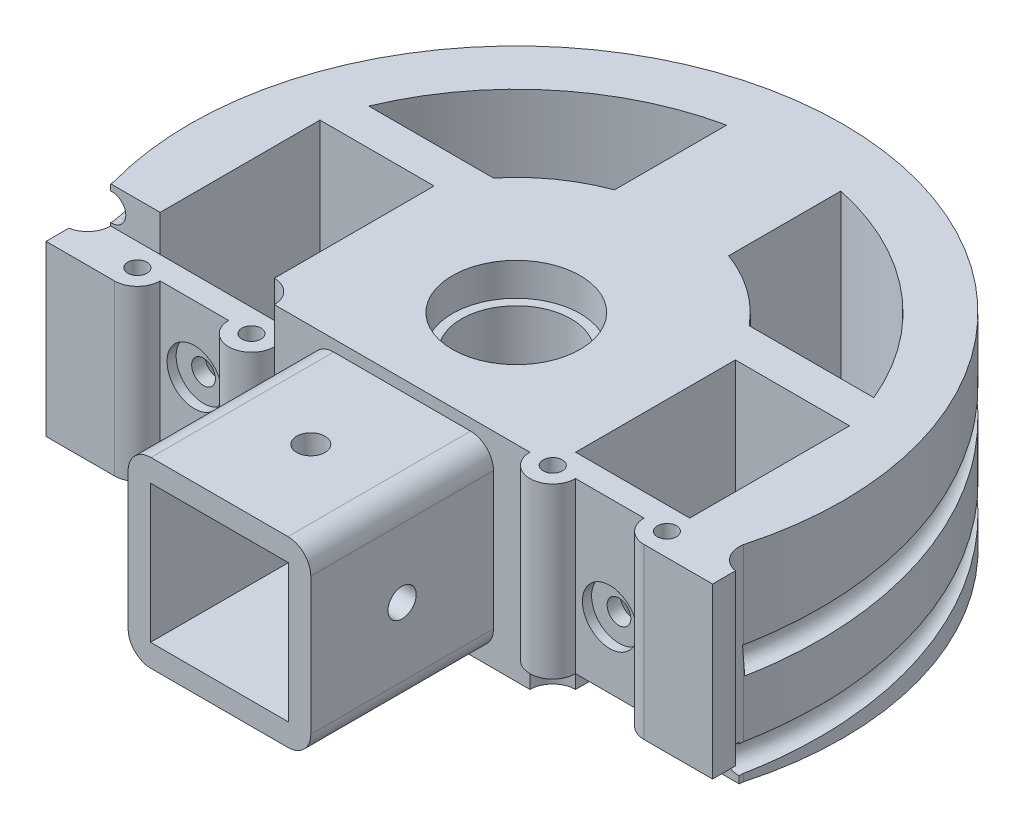
from build123d import *

# Parameters (mm, degrees)
SKETCH1_R               = 25
SKETCH1_R_2             = 14.05
BOSS_EXTRUDE1_DEPTH     = 45
CUT_EXTRUDE1_DEPTH      = 45
BOSS_EXTRUDE2_DEPTH     = 45
CHAMFER1_SIZE           = 4
CHAMFER2_SIZE           = 4
SKETCH5_R               = 5
BOSS_EXTRUDE4_DEPTH     = 45
BOSS_EXTRUDE5_DEPTH     = 45
SKETCH7_R               = 2.1
CUT_EXTRUDE2_DEPTH      = 45
CUT_EXTRUDE5_DEPTH      = 4
CUT_EXTRUDE6_START      = -4
CUT_EXTRUDE6_DEPTH      = 4
CUT_EXTRUDE8_DEPTH      = 105.754474845
SKETCH13_R              = 2.6
CUT_EXTRUDE9_DEPTH      = 59
SKETCH14_R              = 6.25
CUT_EXTRUDE10_DEPTH     = 2
CUT_EXTRUDE11_START     = -2
SKETCH15_R              = 6.25
CUT_EXTRUDE11_DEPTH     = 2
SKETCH16_R              = 2.6
CUT_EXTRUDE12_DEPTH     = 58
SKETCH17_R              = 6.25
CUT_EXTRUDE13_DEPTH     = 2
CUT_EXTRUDE14_START     = -2
SKETCH18_R              = 6.25
CUT_EXTRUDE14_DEPTH     = 2
SKETCH19_R              = 14.05
SKETCH19_R_2            = 11
BOSS_EXTRUDE7_DEPTH     = 45
SKETCH20_R              = 14.1
CUT_EXTRUDE15_DEPTH     = 7.2
CUT_EXTRUDE16_START     = -7.2
SKETCH21_R              = 14.1
CUT_EXTRUDE16_DEPTH     = 7.2
SKETCH22_W              = 40
SKETCH22_H              = 40
SKETCH22_W_2            = 30.2
SKETCH22_H_2            = 30.2
BOSS_EXTRUDE8_DEPTH     = 40
SKETCH23_W              = 40
SKETCH23_H              = 40
SKETCH23_W_2            = 30.2
SKETCH23_H_2            = 30.2
BOSS_EXTRUDE9_DEPTH     = 10
FILLET3_R               = 5
SKETCH24_R              = 3.1
CUT_EXTRUDE17_DEPTH     = 42
SKETCH25_R              = 3.1
CUT_EXTRUDE18_DEPTH     = 42
SKETCH26_W              = 30.2
SKETCH26_H              = 30.2
BOSS_EXTRUDE10_DEPTH    = 8
BOSS_EXTRUDE11_REACH    = 106.754
SKETCH27_R              = 14.1
SKETCH27_R_2            = 14
SKETCH28_R              = 11
SKETCH28_R_2            = 7.5
BOSS_EXTRUDE12_DEPTH    = 30.6
BOSS_EXTRUDE13_START    = -45
SKETCH29_R              = 14
BOSS_EXTRUDE13_DEPTH    = 45
CUT_EXTRUDE19_START     = -60
SKETCH30_R              = 76.647574574
SKETCH30_R_2            = 71.5
CUT_EXTRUDE19_DEPTH     = 60
SKETCH32_R              = 5
SKETCH32_R_2            = 2.1
BOSS_EXTRUDE14_DEPTH    = 45
SKETCH33_W              = 15.39767617
SKETCH33_H              = 7.776614116
SKETCH33_W_2            = 17.569143322
CUT_EXTRUDE23_DEPTH     = 60
SKETCH38_R              = 5
BOSS_EXTRUDE18_DEPTH    = 45
SKETCH39_R              = 2.1
CUT_EXTRUDE24_DEPTH     = 60
SKETCH40_W              = 25
SKETCH40_H              = 35
CUT_EXTRUDE25_DEPTH     = 60
CUT_EXTRUDE27_DEPTH     = 60
SKETCH43_R              = 2.6
CUT_EXTRUDE28_DEPTH     = 53
SKETCH46_R              = 6
CUT_EXTRUDE29_DEPTH     = 5
CUT_EXTRUDE30_START     = -2
SKETCH47_R              = 6
CUT_EXTRUDE30_DEPTH     = 2
BOSS_EXTRUDE19_DEPTH    = 45
BOSS_EXTRUDE20_DEPTH    = 45
CUT_EXTRUDE31_DEPTH     = 8
CUT_EXTRUDE32_START     = -8
CUT_EXTRUDE32_DEPTH     = 8
CUT_SWEEP16_PITCH       = 30
CUT_SWEEP16_HEIGHT      = 18
CUT_SWEEP16_RADIUS      = 71.5
CUT_SWEEP16_START_ANGLE = -110.5
CUT_SWEEP16_PROFILE_R   = 3
CUT_SWEEP17_PITCH       = 30.5
CUT_SWEEP17_HEIGHT      = 18.3
CUT_SWEEP17_RADIUS      = 71.5
CUT_SWEEP17_START_ANGLE = -105.5
CUT_SWEEP17_PROFILE_R   = 3
SKETCH134_R             = 12
CUT_EXTRUDE33_DEPTH     = 30.6


with BuildPart() as part:
    # Sketch1 → Boss-Extrude1 (new body)
    # profile 1 of 2: a face of its own
    with BuildSketch(Plane(origin=(0, 0, 0), x_dir=(1, 0, 0), z_dir=(0, 1, 0))):
        Circle(SKETCH1_R)
        with Locations(Location((0, 0, 0), (0, 0, 90))):
            Circle(SKETCH1_R_2, mode=Mode.SUBTRACT)
    # profile 2 of 2: a face of its own
    with BuildSketch(Plane(origin=(0, 0, 0), x_dir=(1, 0, 0), z_dir=(0, 1, 0))):
        with BuildLine():
            Line((-62.39343856, 27.038099501), (-17.67766953, -17.67766953))
            ThreePointArc((-17.67766953, -17.67766953), (-9.567085809, 23.096988313), (25, 0))
            ThreePointArc((25, 0), (23.096988313, -9.567085809), (17.67766953, -17.67766953))
            Line((17.67766953, -17.67766953), (62.39343856, 27.038099501))
            ThreePointArc((62.39343856, 27.038099501), (0, 68), (-62.39343856, 27.038099501))
        make_face()
        Polygon((-33.941125497, 8.485281374), (-51.618795027, 26.162950904), (-33.941125497, 43.840620434), (-16.263455967, 26.162950904), align=None, mode=Mode.SUBTRACT)
        Polygon((33.941125497, 43.840620434), (51.618795027, 26.162950904), (33.941125497, 8.485281374), (16.263455967, 26.162950904), align=None, mode=Mode.SUBTRACT)
    extrude(amount=BOSS_EXTRUDE1_DEPTH)

    # Sketch2 → Cut-Extrude1 (cut)
    with BuildSketch(Plane(origin=(0, 45, 0), x_dir=(1, 0, 0), z_dir=(0, 1, 0))):
        Polygon((-51.618795027, 26.162950904), (-23.334523779, 54.447222151), (-5.656854249, 36.769552622), (-33.941125497, 8.485281374), align=None)
        Polygon((33.941125497, 8.485281374), (5.656854249, 36.769552622), (23.334523779, 54.447222151), (51.618795027, 26.162950904), align=None)
    extrude(amount=-CUT_EXTRUDE1_DEPTH, mode=Mode.SUBTRACT)

    # Sketch3 → Boss-Extrude2 (add)
    with BuildSketch(Plane(origin=(0, 45, 0), x_dir=(1, 0, 0), z_dir=(0, 1, 0))):
        Polygon((-20.506096654, 51.618795027), (-48.790367902, 23.334523779), (-51.618795027, 26.162950904), (-23.334523779, 54.447222151), align=None)
        Polygon((-33.941125497, 8.485281374), (-36.769552622, 11.313708499), (-8.485281374, 39.597979746), (-5.656854249, 36.769552622), align=None)
        Polygon((8.485281374, 39.597979746), (5.656854249, 36.769552622), (33.941125497, 8.485281374), (36.769552622, 11.313708499), align=None)
        Polygon((51.618795027, 26.162950904), (23.334523779, 54.447222151), (20.506096654, 51.618795027), (48.790367902, 23.334523779), align=None)
    extrude(amount=-BOSS_EXTRUDE2_DEPTH)

    # Chamfer1
    chamfer1_edges = [part.edges().sort_by_distance(p)[0] for p in [
        (22.627416998, 45, -25.455844123),
        (34.648232278, 45, -37.476659403),
        (-34.648232278, 45, -37.476659403),
        (-22.627416998, 45, -25.455844123),
    ]]
    chamfer(chamfer1_edges, length=CHAMFER1_SIZE)

    # Chamfer2
    chamfer2_edges = [part.edges().sort_by_distance(p)[0] for p in [
        (22.627416998, 0, -25.455844123),
        (34.648232278, 0, -37.476659403),
        (-34.648232278, 0, -37.476659403),
        (-22.627416998, 0, -25.455844123),
    ]]
    chamfer(chamfer2_edges, length=CHAMFER2_SIZE)

    # Sketch5 → Boss-Extrude4 (add)
    with BuildSketch(Plane(origin=(0, 45, 0), x_dir=(1, 0, 0), z_dir=(0, 1, 0))):
        with Locations((-57.982756057, 22.627416998)):
            Circle(SKETCH5_R)
        with Locations((-37.476659403, 2.121320344)):
            Circle(SKETCH5_R)
        with Locations((37.476659403, 2.121320344)):
            Circle(SKETCH5_R)
        with Locations((57.982756057, 22.627416998)):
            Circle(SKETCH5_R)
    extrude(amount=-BOSS_EXTRUDE4_DEPTH)

    # Sketch6 → Boss-Extrude5 (add)
    with BuildSketch(Plane(origin=(0, 45, 0), x_dir=(1, 0, 0), z_dir=(0, 1, 0))):
        with BuildLine():
            Line((-61.518289963, 26.162950904), (-65.76093065, 30.405591591))
            Line((-65.76093065, 30.405591591), (-63.901330634, 33.947044369))
            ThreePointArc((-63.901330634, 33.947044369), (-59.108926918, 35.861508459), (-55.392465948, 39.442042495))
            Line((-55.392465948, 39.442042495), (-61.518289963, 26.162950904))
        make_face()
        with BuildLine():
            Line((65.76093065, 30.405591591), (63.901330634, 33.947044369))
            ThreePointArc((63.901330634, 33.947044369), (59.108926918, 35.861508459), (55.392465948, 39.442042495))
            Line((55.392465948, 39.442042495), (61.518289963, 26.162950904))
            Line((61.518289963, 26.162950904), (65.76093065, 30.405591591))
        make_face()
    extrude(amount=-BOSS_EXTRUDE5_DEPTH)

    # Sketch7 → Cut-Extrude2 (cut)
    with BuildSketch(Plane(origin=(0, 45, 0), x_dir=(1, 0, 0), z_dir=(0, 1, 0))):
        with Locations(Location((-57.982756057, 22.627416998, 0), (0, 0, 270))):
            Circle(SKETCH7_R)
        with Locations(Location((-37.476659403, 2.121320344, 0), (0, 0, 270))):
            Circle(SKETCH7_R)
        with Locations(Location((57.982756057, 22.627416998, 0), (0, 0, 270))):
            Circle(SKETCH7_R)
        with Locations(Location((37.476659403, 2.121320344, 0), (0, 0, 270))):
            Circle(SKETCH7_R)
    extrude(amount=-CUT_EXTRUDE2_DEPTH, mode=Mode.SUBTRACT)

    # Sketch9 → Cut-Extrude5 (cut)
    with BuildSketch(Plane(origin=(0, 45, 0), x_dir=(1, 0, 0), z_dir=(0, 1, 0))):
        with BuildLine():
            Line((34.430855211, 8.975011088), (63.662724611, 38.206880488))
            Line((63.662724611, 38.206880488), (69.319578861, 32.550026239))
            Line((69.319578861, 32.550026239), (61.518289963, 26.162950904))
            ThreePointArc((61.518289963, 26.162950904), (61.518289963, 19.091883092), (54.447222151, 19.091883092))
            Line((54.447222151, 19.091883092), (42.779960262, 7.424621202))
            ThreePointArc((42.779960262, 7.424621202), (36.107353009, -5.252620258), (34.430855211, 8.975011088))
        make_face()
        with BuildLine():
            Line((-54.447222151, 19.091883092), (-42.779960262, 7.424621202))
            ThreePointArc((-42.779960262, 7.424621202), (-36.107353009, -5.252620258), (-34.430855211, 8.975011088))
            Line((-34.430855211, 8.975011088), (-63.662724611, 38.206880488))
            Line((-63.662724611, 38.206880488), (-69.319578861, 32.550026239))
            Line((-69.319578861, 32.550026239), (-61.518289963, 26.162950904))
            ThreePointArc((-61.518289963, 26.162950904), (-61.518289963, 19.091883092), (-54.447222151, 19.091883092))
        make_face()
    extrude(amount=-CUT_EXTRUDE5_DEPTH, mode=Mode.SUBTRACT)

    # Sketch10 → Cut-Extrude6 (cut)
    with BuildSketch(Plane(origin=(0, 0, 0), x_dir=(-1, 0, 0), z_dir=(0, -1, 0)).offset(CUT_EXTRUDE6_START)):
        with BuildLine():
            Line((-34.430855211, 8.975011088), (-64.753514476, 39.297670354))
            Line((-64.753514476, 39.297670354), (-71.152151943, 32.899032887))
            Line((-71.152151943, 32.899032887), (-62.982756057, 22.627416998))
            ThreePointArc((-62.982756057, 22.627416998), (-61.363317821, 18.943424305), (-57.554035193, 17.645831064))
            Line((-57.554035193, 17.645831064), (-44.542961969, 4.63475784))
            ThreePointArc((-44.542961969, 4.63475784), (-34.518526316, -4.770664033), (-34.430855211, 8.975011088))
        make_face()
        with BuildLine():
            Line((71.152151943, 32.899032887), (62.982756057, 22.627416998))
            ThreePointArc((62.982756057, 22.627416998), (61.363317821, 18.943424305), (57.554035193, 17.645831064))
            Line((57.554035193, 17.645831064), (44.542961969, 4.63475784))
            ThreePointArc((44.542961969, 4.63475784), (34.518526316, -4.770664033), (34.430855211, 8.975011088))
            Line((34.430855211, 8.975011088), (64.753514476, 39.297670354))
            Line((64.753514476, 39.297670354), (71.152151943, 32.899032887))
        make_face()
    extrude(amount=CUT_EXTRUDE6_DEPTH, mode=Mode.SUBTRACT)

    # Sketch11 → Cut-Extrude8 (cut, through all)
    with BuildSketch(Plane(origin=(0, 45, 0), x_dir=(1, 0, 0), z_dir=(0, 1, 0))):
        with BuildLine():
            Line((0, 39.597979746), (-17.113067777, 56.711047524))
            ThreePointArc((-17.113067777, 56.711047524), (0, 59.236812878), (17.113067777, 56.711047524))
            Line((17.113067777, 56.711047524), (0, 39.597979746))
        make_face()
    extrude(amount=-CUT_EXTRUDE8_DEPTH, mode=Mode.SUBTRACT)

    # Sketch13 → Cut-Extrude9 (cut)
    with BuildSketch(Plane(origin=(17.67766953, 0, 17.67766953), x_dir=(0.7071067811865512, 0, -0.7071067811865438), z_dir=(0.7071067811865438, 0, 0.7071067811865512))):
        with Locations((42.5, 22.5)):
            Circle(SKETCH13_R)
    extrude(amount=-CUT_EXTRUDE9_DEPTH, mode=Mode.SUBTRACT)

    # Sketch14 → Cut-Extrude10 (cut)
    with BuildSketch(Plane(origin=(17.67766953, 0, 17.67766953), x_dir=(0.7071067811865512, 0, -0.7071067811865438), z_dir=(0.7071067811865438, 0, 0.7071067811865512))):
        with Locations((42.5, 22.5)):
            Circle(SKETCH14_R)
    extrude(amount=-CUT_EXTRUDE10_DEPTH, mode=Mode.SUBTRACT)

    # Sketch15 → Cut-Extrude11 (cut)
    with BuildSketch(Plane(origin=(-19.798989873, 0, -19.798989873), x_dir=(-0.7071067811865487, 0, 0.7071067811865465), z_dir=(-0.7071067811865465, 0, -0.7071067811865487)).offset(CUT_EXTRUDE11_START)):
        with Locations(Location((-42.5, 22.5, 0), (0, 0, 180))):
            Circle(SKETCH15_R)
    extrude(amount=CUT_EXTRUDE11_DEPTH, mode=Mode.SUBTRACT)

    # Sketch16 → Cut-Extrude12 (cut)
    with BuildSketch(Plane(origin=(-17.67766953, 0, 17.67766953), x_dir=(0.7071067811865512, 0, 0.7071067811865438), z_dir=(-0.7071067811865438, 0, 0.7071067811865512))):
        with Locations((-42.5, 22.5)):
            Circle(SKETCH16_R)
    extrude(amount=-CUT_EXTRUDE12_DEPTH, mode=Mode.SUBTRACT)

    # Sketch17 → Cut-Extrude13 (cut)
    with BuildSketch(Plane(origin=(-17.67766953, 0, 17.67766953), x_dir=(0.7071067811865512, 0, 0.7071067811865438), z_dir=(-0.7071067811865438, 0, 0.7071067811865512))):
        with Locations((-42.5, 22.5)):
            Circle(SKETCH17_R)
    extrude(amount=-CUT_EXTRUDE13_DEPTH, mode=Mode.SUBTRACT)

    # Sketch18 → Cut-Extrude14 (cut)
    with BuildSketch(Plane(origin=(19.798989873, 0, -19.798989873), x_dir=(-0.7071067811865475, 0, -0.7071067811865477), z_dir=(0.7071067811865477, 0, -0.7071067811865475)).offset(CUT_EXTRUDE14_START)):
        with Locations(Location((42.5, 22.5, 0), (0, 0, 180))):
            Circle(SKETCH18_R)
    extrude(amount=CUT_EXTRUDE14_DEPTH, mode=Mode.SUBTRACT)

    # Sketch19 → Boss-Extrude7 (add)
    with BuildSketch(Plane(origin=(0, 0, 0), x_dir=(-1, 0, 0), z_dir=(0, -1, 0))):
        Circle(SKETCH19_R)
        with Locations(Location((0, 0, 0), (0, 0, 90))):
            Circle(SKETCH19_R_2, mode=Mode.SUBTRACT)
    extrude(amount=-BOSS_EXTRUDE7_DEPTH)

    # Sketch20 → Cut-Extrude15 (cut)
    with BuildSketch(Plane(origin=(0, 45, 0), x_dir=(1, 0, 0), z_dir=(0, 1, 0))):
        with Locations(Location((0, 0, 0), (0, 0, 270))):
            Circle(SKETCH20_R)
    extrude(amount=-CUT_EXTRUDE15_DEPTH, mode=Mode.SUBTRACT)

    # Sketch21 → Cut-Extrude16 (cut)
    with BuildSketch(Plane(origin=(0, 0, 0), x_dir=(-1, 0, 0), z_dir=(0, -1, 0)).offset(CUT_EXTRUDE16_START)):
        with Locations(Location((0, 0, 0), (0, 0, 270))):
            Circle(SKETCH21_R)
    extrude(amount=CUT_EXTRUDE16_DEPTH, mode=Mode.SUBTRACT)



with BuildPart() as body_2:
    # Sketch22 → Boss-Extrude8 (new body)
    with BuildSketch(Plane.XY.offset(25)):
        with Locations((0, 22.5)):
            Rectangle(SKETCH22_W, SKETCH22_H)
        with Locations((0, 22.5)):
            Rectangle(SKETCH22_W_2, SKETCH22_H_2, mode=Mode.SUBTRACT)
    extrude(amount=BOSS_EXTRUDE8_DEPTH)


with BuildPart() as part_1:
    add(part.part)

    add(body_2.part)  # Boss-Extrude9 merges body 2
    # Sketch23 → Boss-Extrude9 (add)
    with BuildSketch(Plane(origin=(0, 0, 25), x_dir=(-1, 0, 0), z_dir=(0, 0, -1))):
        with Locations((0, 22.5)):
            Rectangle(SKETCH23_W, SKETCH23_H)
        with Locations((0, 22.5)):
            Rectangle(SKETCH23_W_2, SKETCH23_H_2, mode=Mode.SUBTRACT)
    extrude(amount=BOSS_EXTRUDE9_DEPTH)

    # Fillet3
    fillet3_edges = [part_1.edges().sort_by_distance(p)[0] for p in [
        (-20, 2.5, 40.17766953),
        (-20, 42.5, 40.17766953),
        (20, 2.5, 40.17766953),
        (20, 42.5, 40.17766953),
    ]]
    fillet(fillet3_edges, radius=FILLET3_R)

    # Sketch24 → Cut-Extrude17 (cut)
    with BuildSketch(Plane(origin=(0, 42.5, 0), x_dir=(1, 0, 0), z_dir=(0, 1, 0))):
        with Locations(Location((0, -45, 0), (0, 0, 270))):
            Circle(SKETCH24_R)
    extrude(amount=-CUT_EXTRUDE17_DEPTH, mode=Mode.SUBTRACT)

    # Sketch25 → Cut-Extrude18 (cut)
    with BuildSketch(Plane.ZY.offset(20)):
        with Locations((45, 22.5)):
            Circle(SKETCH25_R)
    extrude(amount=-CUT_EXTRUDE18_DEPTH, mode=Mode.SUBTRACT)

    # Sketch26 → Boss-Extrude10 (add)
    with BuildSketch(Plane.XY.offset(25)):
        with Locations((0, 22.5)):
            Rectangle(SKETCH26_W, SKETCH26_H)
    extrude(amount=-BOSS_EXTRUDE10_DEPTH)

    # Boss-Extrude11: up to this face of the body (flat: up to its plane)
    boss_extrude11_end = Plane(part_1.part.faces().sort_by_distance((0, 45, -25.755665333))[0])
    # Sketch27 → Boss-Extrude11 (add, up to the picked face)
    with BuildSketch(Plane(origin=(0, 0, 0), x_dir=(-1, 0, 0), z_dir=(0, -1, 0)), mode=Mode.PRIVATE) as boss_extrude11_sk1:
        Circle(SKETCH27_R)
        with Locations(Location((0, 0, 0), (0, 0, 90))):
            Circle(SKETCH27_R_2, mode=Mode.SUBTRACT)
    boss_extrude11_tool1 = split(extrude(boss_extrude11_sk1.sketch, amount=-BOSS_EXTRUDE11_REACH, mode=Mode.PRIVATE), bisect_by=boss_extrude11_end, keep=Keep.BOTH, mode=Mode.PRIVATE)
    add(boss_extrude11_tool1.solids().sort_by(Axis((14.060119, 0, 0), (0, 1, 0)))[0])

    # Sketch28 → Boss-Extrude12 (add)
    with BuildSketch(Plane(origin=(0, 7.2, 0), x_dir=(-1, 0, 0), z_dir=(0, -1, 0))):
        Circle(SKETCH28_R)
        with Locations(Location((0, 0, 0), (0, 0, 90))):
            Circle(SKETCH28_R_2, mode=Mode.SUBTRACT)
    extrude(amount=-BOSS_EXTRUDE12_DEPTH)

    # Sketch29 → Boss-Extrude13 (add)
    with BuildSketch(Plane(origin=(0, 45, 0), x_dir=(1, 0, 0), z_dir=(0, 1, 0)).offset(BOSS_EXTRUDE13_START)):
        with BuildLine():
            Line((0, -25), (-66.986939025, -25))
            ThreePointArc((-66.986939025, -25), (0, 71.5), (66.986939025, -25))
            Line((66.986939025, -25), (0, -25))
        make_face()
        with Locations(Location((0, 0, 0), (0, 0, 270))):
            Circle(SKETCH29_R, mode=Mode.SUBTRACT)
    extrude(amount=BOSS_EXTRUDE13_DEPTH)

    # Sketch30 → Cut-Extrude19 (cut)
    with BuildSketch(Plane(origin=(0, 45, 0), x_dir=(1, 0, 0), z_dir=(0, 1, 0)).offset(CUT_EXTRUDE19_START)):
        Circle(SKETCH30_R)
        Circle(SKETCH30_R_2, mode=Mode.SUBTRACT)
    extrude(amount=CUT_EXTRUDE19_DEPTH, mode=Mode.SUBTRACT)

    # Sketch32 → Boss-Extrude14 (add)
    # profile 1 of 4: a face of its own
    with BuildSketch(Plane(origin=(0, 45, 0), x_dir=(1, 0, 0), z_dir=(0, 1, 0))):
        with Locations((-57.986939025, -25)):
            Circle(SKETCH32_R)
        with Locations((-57.986939025, -25)):
            Circle(SKETCH32_R_2, mode=Mode.SUBTRACT)
    # profile 2 of 4: a face of its own
    with BuildSketch(Plane(origin=(0, 45, 0), x_dir=(1, 0, 0), z_dir=(0, 1, 0))):
        with Locations((-36.962147295, -25)):
            Circle(SKETCH32_R)
        with Locations((-36.962147295, -25)):
            Circle(SKETCH32_R_2, mode=Mode.SUBTRACT)
    # profile 3 of 4: a face of its own
    with BuildSketch(Plane(origin=(0, 45, 0), x_dir=(1, 0, 0), z_dir=(0, 1, 0))):
        with Locations((36.962147295, -25)):
            Circle(SKETCH32_R)
        with Locations((36.962147295, -25)):
            Circle(SKETCH32_R_2, mode=Mode.SUBTRACT)
    # profile 4 of 4: a face of its own
    with BuildSketch(Plane(origin=(0, 45, 0), x_dir=(1, 0, 0), z_dir=(0, 1, 0))):
        with Locations((57.986939025, -25)):
            Circle(SKETCH32_R)
        with Locations((57.986939025, -25)):
            Circle(SKETCH32_R_2, mode=Mode.SUBTRACT)
    extrude(amount=-BOSS_EXTRUDE14_DEPTH)

    # Sketch33 → Cut-Extrude23 (cut)
    with BuildSketch(Plane(origin=(0, 45, 0), x_dir=(1, 0, 0), z_dir=(0, 1, 0))):
        with Locations((-37.112347692, -28.888307058)):
            Rectangle(SKETCH33_W, SKETCH33_H)
        with Locations((36.026614116, -28.888307058)):
            Rectangle(SKETCH33_W_2, SKETCH33_H)
    extrude(amount=-CUT_EXTRUDE23_DEPTH, mode=Mode.SUBTRACT)

    # Sketch38 → Boss-Extrude18 (add)
    with BuildSketch(Plane(origin=(0, 45, 0), x_dir=(1, 0, 0), z_dir=(0, 1, 0))):
        with Locations((-57.986939025, -25)):
            Circle(SKETCH38_R)
        with Locations((57.986939025, -25)):
            Circle(SKETCH38_R)
        with Locations((-32.986939025, -25)):
            Circle(SKETCH38_R)
        with Locations((32.986939025, -25)):
            Circle(SKETCH38_R)
    extrude(amount=-BOSS_EXTRUDE18_DEPTH)

    # Sketch39 → Cut-Extrude24 (cut)
    with BuildSketch(Plane(origin=(0, 45, 0), x_dir=(1, 0, 0), z_dir=(0, 1, 0))):
        with Locations(Location((-57.986939025, -25, 0), (0, 0, 270))):
            Circle(SKETCH39_R)
        with Locations(Location((-32.986939025, -25, 0), (0, 0, 270))):
            Circle(SKETCH39_R)
        with Locations(Location((32.986939025, -25, 0), (0, 0, 270))):
            Circle(SKETCH39_R)
        with Locations(Location((57.986939025, -25, 0), (0, 0, 270))):
            Circle(SKETCH39_R)
    extrude(amount=-CUT_EXTRUDE24_DEPTH, mode=Mode.SUBTRACT)

    # Sketch40 → Cut-Extrude25 (cut)
    with BuildSketch(Plane(origin=(0, 45, 0), x_dir=(1, 0, 0), z_dir=(0, 1, 0))):
        with Locations((-45.486939025, -2.5)):
            Rectangle(SKETCH40_W, SKETCH40_H)
        with Locations((45.486939025, -2.5)):
            Rectangle(SKETCH40_W, SKETCH40_H)
    extrude(amount=-CUT_EXTRUDE25_DEPTH, mode=Mode.SUBTRACT)

    # Sketch42 → Cut-Extrude27 (cut)
    with BuildSketch(Plane(origin=(0, 45, 0), x_dir=(1, 0, 0), z_dir=(0, 1, 0))):
        with BuildLine():
            Line((-55.303572195, 23), (-32.986939025, 23))
            Line((-32.986939025, 23), (-28.002466789, 23))
            ThreePointArc((-28.002466789, 23), (0, 36.23724805), (28.002466789, 23))
            Line((28.002466789, 23), (55.303572195, 23))
            ThreePointArc((55.303572195, 23), (0, 59.89561835), (-55.303572195, 23))
        make_face()
    extrude(amount=-CUT_EXTRUDE27_DEPTH, mode=Mode.SUBTRACT)

    # Sketch43 → Cut-Extrude28 (cut)
    with BuildSketch(Plane.XY.offset(25)):
        with Locations((-45.486939025, 22.5)):
            Circle(SKETCH43_R)
        with Locations((45.486939025, 22.5)):
            Circle(SKETCH43_R)
    extrude(amount=-CUT_EXTRUDE28_DEPTH, mode=Mode.SUBTRACT)

    # Sketch46 → Cut-Extrude29 (cut)
    with BuildSketch(Plane(origin=(0, 0, -23), x_dir=(-1, 0, 0), z_dir=(0, 0, -1))):
        with Locations((45.486939025, 22.5)):
            Circle(SKETCH46_R)
        with Locations((-45.486939025, 22.5)):
            Circle(SKETCH46_R)
    extrude(amount=-CUT_EXTRUDE29_DEPTH, mode=Mode.SUBTRACT)

    # Sketch47 → Cut-Extrude30 (cut)
    with BuildSketch(Plane.XY.offset(25).offset(CUT_EXTRUDE30_START)):
        with Locations(Location((45.486939025, 22.5, 0), (0, 0, 180))):
            Circle(SKETCH47_R)
        with Locations(Location((-45.486939025, 22.5, 0), (0, 0, 180))):
            Circle(SKETCH47_R)
    extrude(amount=CUT_EXTRUDE30_DEPTH, mode=Mode.SUBTRACT)

    # Sketch48 → Boss-Extrude19 (add)
    with BuildSketch(Plane(origin=(0, 45, 0), x_dir=(1, 0, 0), z_dir=(0, 1, 0))):
        with BuildLine():
            Line((-12.5, 34.013058467), (-12.5, 58.576745365))
            ThreePointArc((-12.5, 58.576745365), (0, 59.89561835), (12.5, 58.576745365))
            Line((12.5, 58.576745365), (12.5, 34.013058467))
            ThreePointArc((12.5, 34.013058467), (0, 36.23724805), (-12.5, 34.013058467))
        make_face()
    extrude(amount=-BOSS_EXTRUDE19_DEPTH)

    # Sketch49 → Boss-Extrude20 (add)
    with BuildSketch(Plane(origin=(0, 45, 0), x_dir=(1, 0, 0), z_dir=(0, 1, 0))):
        with BuildLine():
            Line((-57.986939025, -30), (-72.986939025, -30))
            Line((-72.986939025, -30), (-72.986939025, -25))
            ThreePointArc((-72.986939025, -25), (-69.723589873, -22.905990899), (-68.896741593, -19.117766549))
            Line((-68.896741593, -19.117766549), (-66.336012435, -25))
            Line((-66.336012435, -25), (-62.986939025, -25))
            ThreePointArc((-62.986939025, -25), (-61.522472931, -28.535533906), (-57.986939025, -30))
        make_face()
        with BuildLine():
            Line((57.986939025, -30), (72.986939025, -30))
            Line((72.986939025, -30), (72.986939025, -25))
            ThreePointArc((72.986939025, -25), (69.723589873, -22.905990899), (68.896741593, -19.117766549))
            Line((68.896741593, -19.117766549), (66.336012435, -25))
            Line((66.336012435, -25), (62.986939025, -25))
            ThreePointArc((62.986939025, -25), (61.522472931, -28.535533906), (57.986939025, -30))
        make_face()
    extrude(amount=-BOSS_EXTRUDE20_DEPTH)

    # Sketch50 → Cut-Extrude31 (cut)
    with BuildSketch(Plane(origin=(0, 45, 0), x_dir=(1, 0, 0), z_dir=(0, 1, 0))):
        with BuildLine():
            Line((-32.986939025, -20), (-80.509399284, -20))
            Line((-80.509399284, -20), (-80.509399284, -36.527330106))
            Line((-80.509399284, -36.527330106), (-32.986939025, -36.527330106))
            Line((-32.986939025, -36.527330106), (-32.986939025, -30))
            ThreePointArc((-32.986939025, -30), (-27.986939025, -25), (-32.986939025, -20))
        make_face()
    extrude(amount=-CUT_EXTRUDE31_DEPTH, mode=Mode.SUBTRACT)

    # Sketch51 → Cut-Extrude32 (cut)
    with BuildSketch(Plane.XZ.offset(CUT_EXTRUDE32_START)):
        with BuildLine():
            Line((32.986939025, 20), (85.180213502, 20))
            Line((85.180213502, 20), (85.180213502, 38.94759176))
            Line((85.180213502, 38.94759176), (32.986939025, 38.94759176))
            Line((32.986939025, 38.94759176), (32.986939025, 30))
            ThreePointArc((32.986939025, 30), (27.986939025, 25), (32.986939025, 20))
        make_face()
    extrude(amount=CUT_EXTRUDE32_DEPTH, mode=Mode.SUBTRACT)

    # Cut-Sweep16: sweep along a helix
    with BuildLine() as cut_sweep16_path:
        add(Helix(CUT_SWEEP16_PITCH, CUT_SWEEP16_HEIGHT, CUT_SWEEP16_RADIUS, center=(0, 41, 0), direction=(0, -1, 0), mode=Mode.PRIVATE).rotate(Axis((0, 41, 0), (0, -1, 0)), CUT_SWEEP16_START_ANGLE))
    # Cut-Sweep16 profile (on start of the path) → Cut-Sweep16 (sweep, cut)
    with BuildSketch(Plane(origin=(-66.972061531, 41, 25.03982776), x_dir=(-0.9366721892481856, 0, 0.35020738126003453), z_dir=(-0.34942913606361226, -0.06662990033057735, -0.9345906779182932))):
        Circle(CUT_SWEEP16_PROFILE_R)
    sweep(path=cut_sweep16_path.line, is_frenet=True, mode=Mode.SUBTRACT)

    # Cut-Sweep17: sweep along a helix
    with BuildLine() as cut_sweep17_path:
        add(Helix(CUT_SWEEP17_PITCH, CUT_SWEEP17_HEIGHT, CUT_SWEEP17_RADIUS, center=(0, 22.5, 0), direction=(0, -1, 0), mode=Mode.PRIVATE).rotate(Axis((0, 22.5, 0), (0, -1, 0)), CUT_SWEEP17_START_ANGLE))
    # Cut-Sweep17 profile (on start of the path) → Cut-Sweep17 (sweep, cut)
    with BuildSketch(Plane(origin=(-68.899577404, 22.5, 19.10754389), x_dir=(-0.9636304532086301, 0, 0.2672383760782315), z_dir=(-0.2666246161526044, -0.067735345191532, -0.9614173064144729))):
        Circle(CUT_SWEEP17_PROFILE_R)
    sweep(path=cut_sweep17_path.line, is_frenet=True, mode=Mode.SUBTRACT)

    # Sketch134 → Cut-Extrude33 (cut)
    with BuildSketch(Plane(origin=(0, 7.2, 0), x_dir=(-1, 0, 0), z_dir=(0, -1, 0))):
        with Locations(Location((0, 0, 0), (0, 0, 90))):
            Circle(SKETCH134_R)
    extrude(amount=-CUT_EXTRUDE33_DEPTH, mode=Mode.SUBTRACT)


solid = part_1.part
